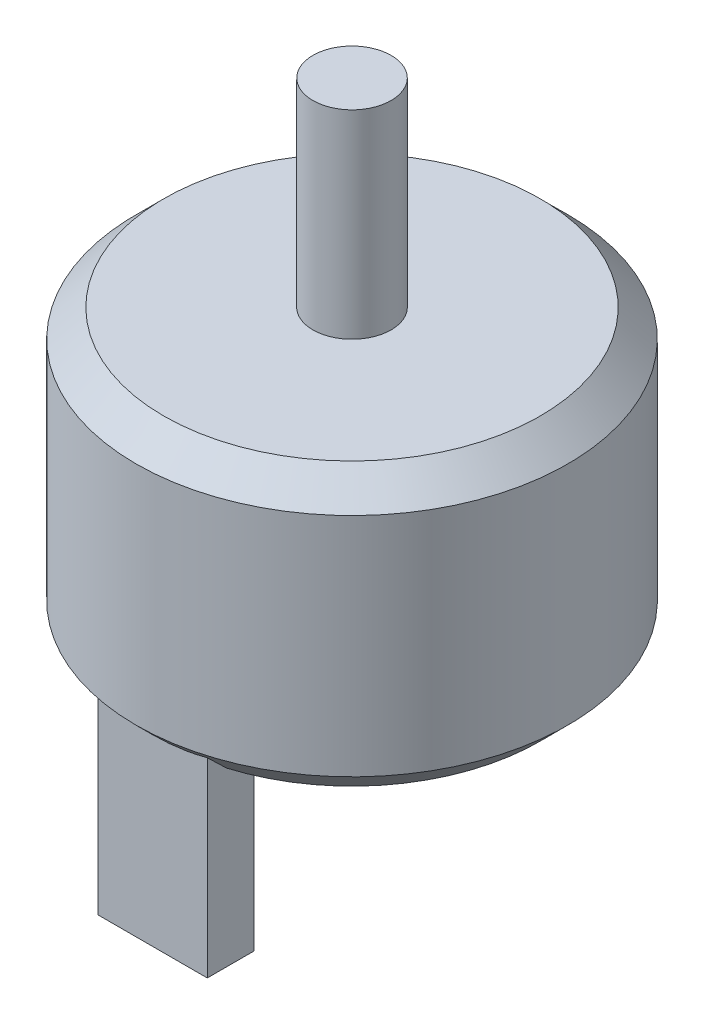
from build123d import *

# Parameters (mm, degrees)
SKETCH1_R                = 13.8
BOSS_EXTRUDE1_DEPTH      = 18
SKETCH3_R                = 2.5
BOSS_EXTRUDE2_DEPTH      = 12.7
BOSS_EXTRUDE3_DEPTH      = 11
BOSS_EXTRUDE3_DEPTH_BACK = 3


with BuildPart() as part:
    # Sketch1 → Boss-Extrude1 (new body)
    with BuildSketch(Plane(origin=(0, 0, 0), x_dir=(1, 0, 0), z_dir=(0, 1, 0))):
        with Locations(Location((0, 0, 0), (0, 0, 270))):
            Circle(SKETCH1_R)
    extrude(amount=BOSS_EXTRUDE1_DEPTH)

    # Sketch2 → Cut-Revolve1 (revolve, cut)
    with BuildSketch(Plane(origin=(0, 0, 0), x_dir=(0, 0, -1), z_dir=(1, 0, 0)), mode=Mode.PRIVATE) as cut_revolve1_sk:
        Polygon((12.032233047, 18), (13.8, 16.232233047), (13.8, 18), align=None)
        Polygon((13.8, 0), (13.8, 1.767766953), (12.032233047, 0), align=None)
    revolve(cut_revolve1_sk.sketch.rotate(Axis((0, 18, 0), (0, -1, 0)), 180), axis=Axis((0, 18, 0), (0, -1, 0)), mode=Mode.SUBTRACT)

    # Sketch3 → Boss-Extrude2 (add)
    with BuildSketch(Plane(origin=(0, 18, 0), x_dir=(1, 0, 0), z_dir=(0, 1, 0))):
        with Locations(Location((0, 0, 0), (0, 0, 270))):
            Circle(SKETCH3_R)
    extrude(amount=BOSS_EXTRUDE2_DEPTH)

    # Sketch4 → Boss-Extrude3 (add, two sides: drawn at the far end of the back side and taken through both)
    with BuildSketch(Plane.XZ.offset(-BOSS_EXTRUDE3_DEPTH_BACK)):
        with BuildLine():
            Line((3.5, 12.75), (-3.5, 12.75))
            Line((-3.5, 12.75), (-3.5, 11.511934333))
            ThreePointArc((-3.5, 11.511934333), (0, 12.032233047), (3.5, 11.511934333))
            Line((3.5, 11.511934333), (3.5, 12.75))
        make_face()
        with BuildLine():
            ThreePointArc((3.5, 11.511934333), (0, 12.032233047), (-3.5, 11.511934333))
            Line((-3.5, 11.511934333), (-3.5, 9.75))
            Line((-3.5, 9.75), (0, 9.75))
            Line((0, 9.75), (3.5, 9.75))
            Line((3.5, 9.75), (3.5, 11.511934333))
        make_face()
    extrude(amount=BOSS_EXTRUDE3_DEPTH + BOSS_EXTRUDE3_DEPTH_BACK)


solid = part.part
